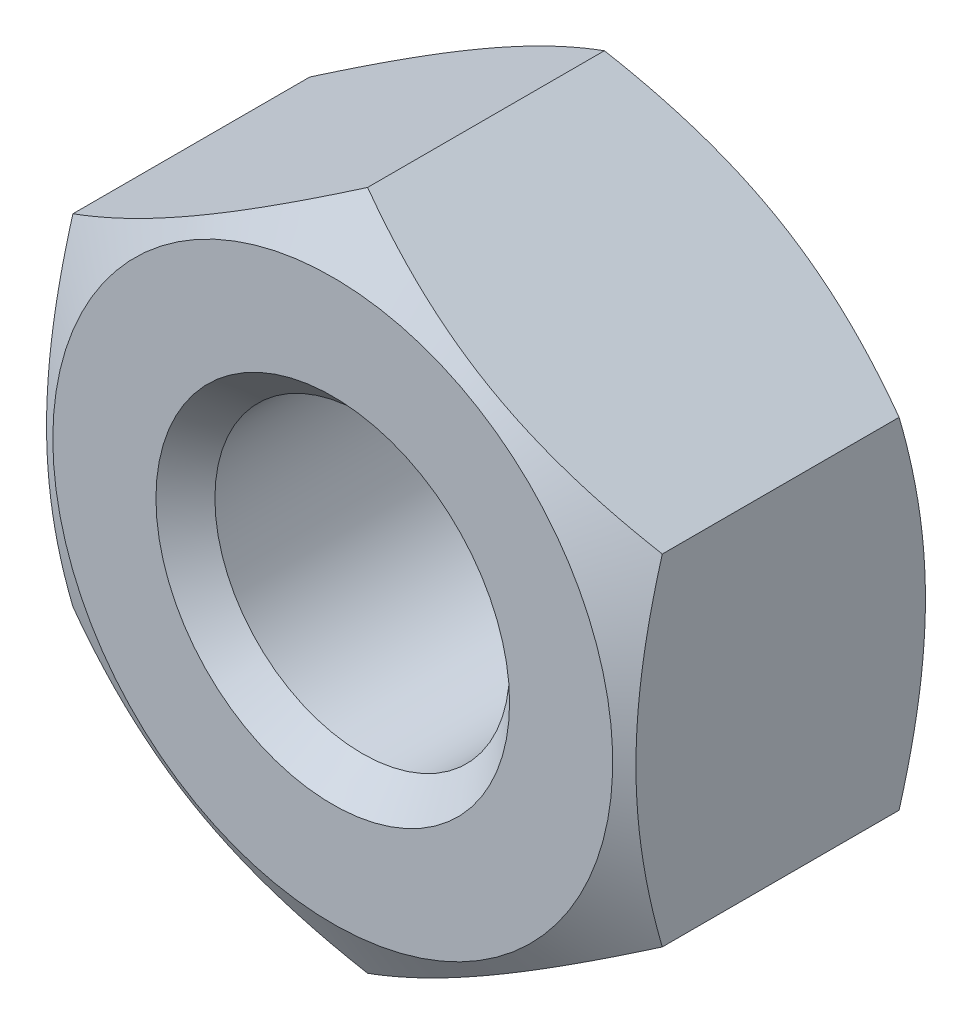
from build123d import *

# Parameters (mm, degrees)
SKETCH_1_R      = 2.5
EXTRUDE_1_DEPTH = 5.2
CHAMFER_1_SIZE  = 0.5


with BuildPart() as part:
    # Эскиз1 → Бобышка-Вытянуть1 (new body)
    with BuildSketch(Plane.XY):
        Polygon((0, 5.773502692), (-5, 2.886751346), (-5, -2.886751346), (0, -5.773502692), (5, -2.886751346), (5, 2.886751346), align=None)
        Circle(SKETCH_1_R, mode=Mode.SUBTRACT)
    extrude(amount=EXTRUDE_1_DEPTH)

    # Эскиз2 → Вырез-Повернуть1 (revolve, cut)
    with BuildSketch(Plane(origin=(0, 0, 0), x_dir=(0, 0, -1), z_dir=(1, 0, 0)), mode=Mode.PRIVATE) as cut_revolve_1_sk:
        Polygon((0, 5.773502692), (-0.590919555, 5.773502692), (0, 4.75), align=None)
        Polygon((-5.2, 4.75), (-5.2, 5.773502692), (-4.609080445, 5.773502692), align=None)
    revolve(cut_revolve_1_sk.sketch.rotate(Axis((0, 0, 0), (0, 0, 1)), 90), axis=Axis((0, 0, 0), (0, 0, 1)), mode=Mode.SUBTRACT)

    # Фаска1
    chamfer_1_edges = [part.edges().sort_by_distance(p)[0] for p in [
        (-2.5, 0, 0),
        (-2.5, 0, 5.2),
    ]]
    chamfer(chamfer_1_edges, length=CHAMFER_1_SIZE)


solid = part.part
